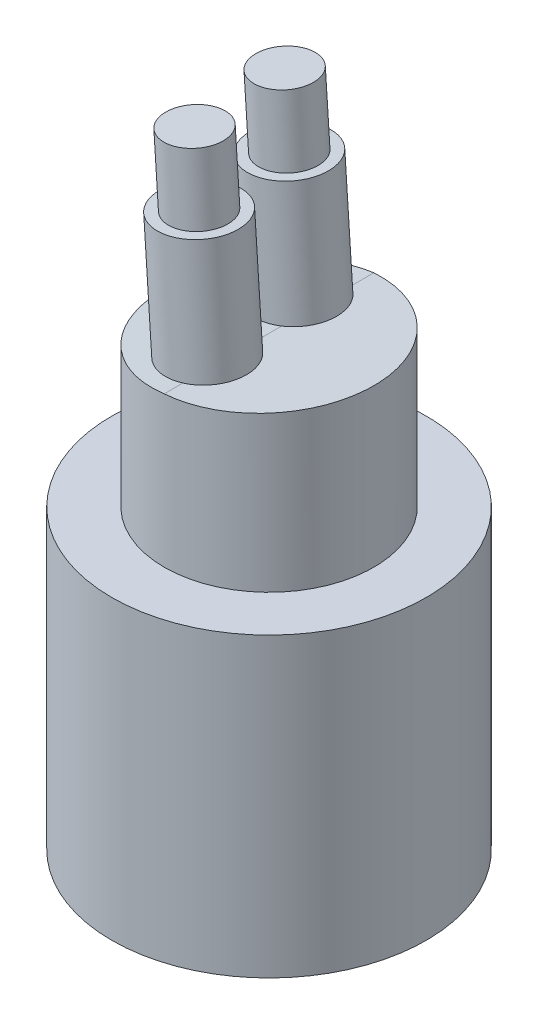
from build123d import *

# Parameters (mm, degrees)
CROQUIS1_R              = 9
SALIENTE_EXTRUIR1_DEPTH = 17
CROQUIS2_R              = 6
SALIENTE_EXTRUIR2_DEPTH = 9
CORTAR_EXTRUIR1_DEPTH   = 9.5
CROQUIS4_R              = 2.25
SALIENTE_EXTRUIR3_DEPTH = 7
CROQUIS5_R              = 1.65
SALIENTE_EXTRUIR4_DEPTH = 4
CROQUIS6_R              = 2.05
CORTAR_EXTRUIR2_DEPTH   = 5


with BuildPart() as part:
    # Croquis1 → Saliente-Extruir1 (new body)
    with BuildSketch(Plane(origin=(0, 0, 0), x_dir=(1, 0, 0), z_dir=(0, 1, 0))):
        with Locations(Location((0, 0, 0), (0, 0, 270))):
            Circle(CROQUIS1_R)
    extrude(amount=SALIENTE_EXTRUIR1_DEPTH)

    # Croquis2 → Saliente-Extruir2 (add)
    with BuildSketch(Plane(origin=(0, 17, 0), x_dir=(1, 0, 0), z_dir=(0, 1, 0))):
        with Locations(Location((0, 0, 0), (0, 0, 270))):
            Circle(CROQUIS2_R)
    extrude(amount=SALIENTE_EXTRUIR2_DEPTH)

    # Croquis3 → Cortar-Extruir1 (cut, symmetric)
    with BuildSketch(Plane.XY):
        Polygon((-6, 24.801), (0, 25.6), (6, 26), (-6, 26), align=None)
    extrude(amount=CORTAR_EXTRUIR1_DEPTH, both=True, mode=Mode.SUBTRACT)

    # Croquis4 → Saliente-Extruir3 (add)
    with BuildSketch(Plane(origin=(-1.699115044, 25.486725664, 0), x_dir=(0.997785157856609, 0.06651901052377411, 0), z_dir=(-0.06651901052377411, 0.997785157856609, 0))):
        with Locations(Location((0.629712535, 2.694122729, 0), (0, 0, 298.487451849))):
            Circle(CROQUIS4_R)
        with Locations(Location((0.970047848, -2.805877271, 0), (0, 0, 70.99163809))):
            Circle(CROQUIS4_R)
    extrude(amount=SALIENTE_EXTRUIR3_DEPTH)

    # Croquis5 → Saliente-Extruir4 (add)
    with BuildSketch(Plane(origin=(-2.164748118, 32.471221769, 0), x_dir=(0.997785157856609, 0.06651901052377412, 0), z_dir=(-0.06651901052377412, 0.997785157856609, 0))):
        with Locations(Location((0.629712535, 2.694122729, 0), (0, 0, 180))):
            Circle(CROQUIS5_R)
        with Locations(Location((0.970047848, -2.805877271, 0), (0, 0, 180))):
            Circle(CROQUIS5_R)
    extrude(amount=SALIENTE_EXTRUIR4_DEPTH)

    # Croquis6 → Cortar-Extruir2 (cut)
    with BuildSketch(Plane.XZ):
        with Locations(Location((0, 0, 0), (0, 0, 270))):
            Circle(CROQUIS6_R)
    extrude(amount=-CORTAR_EXTRUIR2_DEPTH, mode=Mode.SUBTRACT)


solid = part.part
